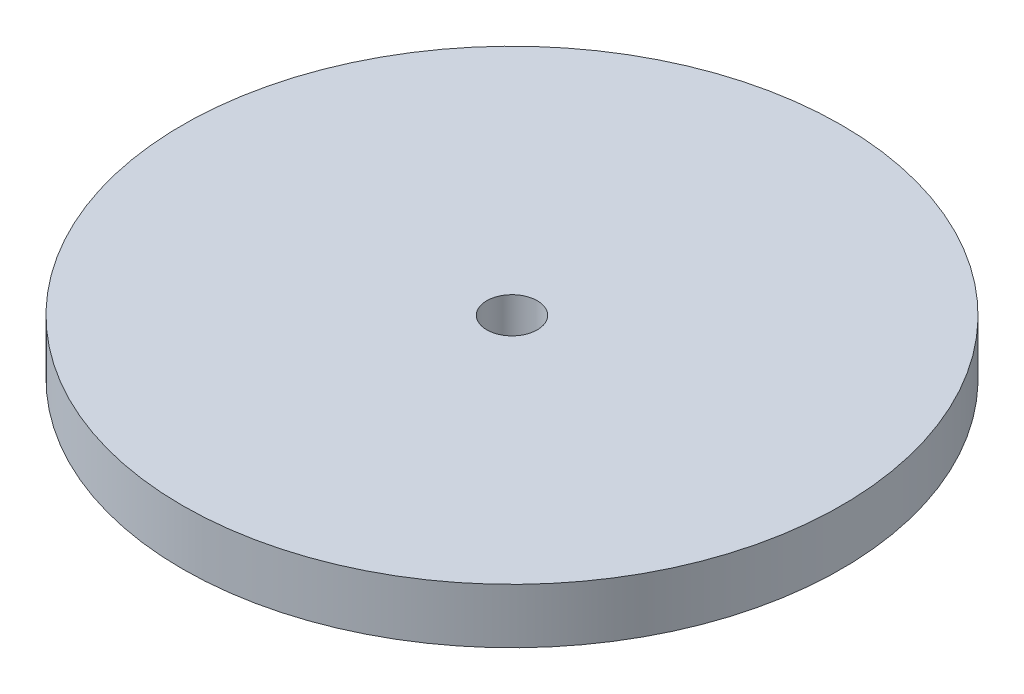
from build123d import *

# Parameters (mm, degrees)
SKETCH2_R           = 19.05
BOSS_EXTRUDE1_DEPTH = 3.175
SKETCH3_R           = 1.4605
CUT_EXTRUDE1_DEPTH  = 28.127211891


with BuildPart() as part:
    # Sketch2 → Boss-Extrude1 (new body)
    with BuildSketch(Plane(origin=(0, 0, 0), x_dir=(1, 0, 0), z_dir=(0, 1, 0))):
        with Locations(Location((0, 0, 0), (0, 0, 270))):
            Circle(SKETCH2_R)
    extrude(amount=BOSS_EXTRUDE1_DEPTH)

    # Sketch3 → Cut-Extrude1 (cut, through all)
    with BuildSketch(Plane(origin=(0, 3.175, 0), x_dir=(1, 0, 0), z_dir=(0, 1, 0))):
        with Locations(Location((0, 0, 0), (0, 0, 270))):
            Circle(SKETCH3_R)
    extrude(amount=-CUT_EXTRUDE1_DEPTH, mode=Mode.SUBTRACT)


solid = part.part
